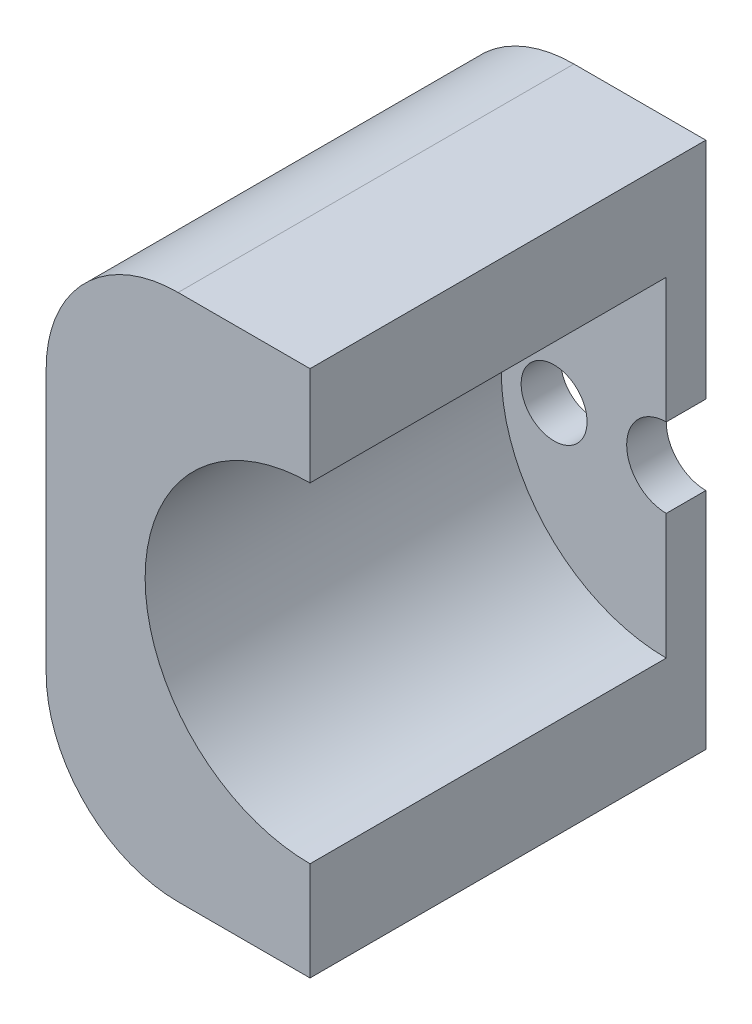
from build123d import *

# Parameters (mm, degrees)
BOSS_EXTRUDE1_DEPTH = 30
SKETCH2_R           = 2.5
BOSS_EXTRUDE2_DEPTH = 3
FILLET1_R           = 10


with BuildPart() as part:
    # Sketch1 → Boss-Extrude1 (new body)
    with BuildSketch(Plane.XY):
        with BuildLine():
            Line((-20, 20), (0, 20))
            Line((0, 20), (0, 12.5))
            ThreePointArc((0, 12.5), (-12.5, 0), (0, -12.5))
            Line((0, -12.5), (0, -20))
            Line((0, -20), (-20, -20))
            Line((-20, -20), (-20, 20))
        make_face()
    extrude(amount=BOSS_EXTRUDE1_DEPTH)

    # Sketch2 → Boss-Extrude2 (add)
    with BuildSketch(Plane(origin=(0, 0, 0), x_dir=(-1, 0, 0), z_dir=(0, 0, -1))):
        with BuildLine():
            Line((0, -12.5), (0, -3))
            ThreePointArc((0, -3), (3, 0), (0, 3))
            Line((0, 3), (0, 12.5))
            ThreePointArc((0, 12.5), (12.5, 0), (0, -12.5))
        make_face()
        with Locations((8.5, 0)):
            Circle(SKETCH2_R, mode=Mode.SUBTRACT)
    extrude(amount=-BOSS_EXTRUDE2_DEPTH)

    # Fillet1
    fillet1_edges = [part.edges().sort_by_distance(p)[0] for p in [
        (-20, -20, 15),
        (-20, 20, 15),
    ]]
    fillet(fillet1_edges, radius=FILLET1_R)


solid = part.part
